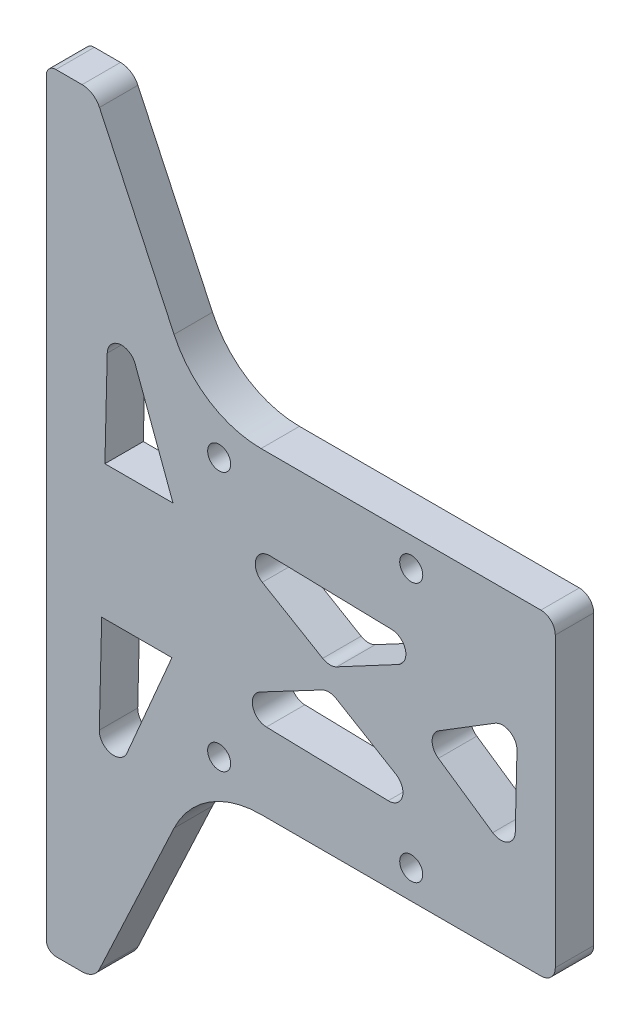
from build123d import *

# Parameters (mm, degrees)
EXTRUDE_1_DEPTH     = 11
CUT_EXTRUDE_START   = -7
CUT_EXTRUDE_1_DEPTH = 7
SKETCH_3_R          = 2.05
CUT_EXTRUDE_2_DEPTH = 37
FILLET_1_R          = 2
EXTRUDE_START       = -4
EXTRUDE_2_DEPTH     = 4
SKETCH_5_W          = 34.461524683
SKETCH_5_H          = 8.345685775
CUT_EXTRUDE_3_DEPTH = 34
SKETCH_6_R          = 1.2
CUT_EXTRUDE_4_DEPTH = 10


with BuildPart() as part:
    # 草图1 → 凸台-拉伸1 (new body)
    with BuildSketch(Plane.XY):
        with BuildLine():
            Line((3.72790966, 78.977626184), (1, 78.977626184))
            ThreePointArc((1, 78.977626184), (0.292893219, 78.684732965), (0, 77.977626184))
            Line((0, 77.977626184), (0, -0.022373816))
            ThreePointArc((0, -0.022373816), (0.292893219, -0.729480597), (1, -1.022373816))
            Line((1, -1.022373816), (3.72790966, -1.022373816))
            ThreePointArc((3.72790966, -1.022373816), (4.801278091, -0.709940174), (5.539290113, 0.129745972))
            Line((5.539290113, 0.129745972), (13.303549433, 16.717027245))
            ThreePointArc((13.303549433, 16.717027245), (16.993609545, 20.915457973), (22.360451698, 22.477626184))
            Line((22.360451698, 22.477626184), (51.5, 22.477626184))
            ThreePointArc((51.5, 22.477626184), (52.560660172, 22.916966012), (53, 23.977626184))
            Line((53, 23.977626184), (53, 53.977626184))
            ThreePointArc((53, 53.977626184), (52.560660172, 55.038286356), (51.5, 55.477626184))
            Line((51.5, 55.477626184), (22.360451698, 55.477626184))
            ThreePointArc((22.360451698, 55.477626184), (16.993609545, 57.039794395), (13.303549433, 61.238225124))
            Line((13.303549433, 61.238225124), (5.539290113, 77.825506396))
            ThreePointArc((5.539290113, 77.825506396), (4.801278091, 78.665192542), (3.72790966, 78.977626184))
        make_face()
        with BuildLine():
            Line((46.723063893, 42.88691809), (40.887588257, 39.289675292))
            ThreePointArc((40.887588257, 39.289675292), (40.373853978, 38.759625352), (40.175145399, 38.048716955))
            ThreePointArc((40.175145399, 38.048716955), (40.339583189, 37.329108685), (40.827345936, 36.77506595))
            Line((40.827345936, 36.77506595), (46.483868127, 32.90251016))
            ThreePointArc((46.483868127, 32.90251016), (48.014920506, 32.805104134), (48.830807058, 34.104310989))
            Line((48.830807058, 34.104310989), (49.009760503, 41.574109577))
            ThreePointArc((49.009760503, 41.574109577), (48.257024254, 42.91089582), (46.723063893, 42.88691809))
        make_face(mode=Mode.SUBTRACT)
        with BuildLine():
            Line((35.975157614, 45.967771208), (23.29289503, 46.27159929))
            ThreePointArc((23.29289503, 46.27159929), (22.222016888, 45.857788357), (21.757400208, 44.807954643))
            ThreePointArc((21.757400208, 44.807954643), (21.945365563, 44.044228792), (22.493939434, 43.480602267))
            Line((22.493939434, 43.480602267), (28.780793319, 39.766059947))
            ThreePointArc((28.780793319, 39.766059947), (29.511034587, 39.557845657), (30.249678725, 39.733943182))
            Line((30.249678725, 39.733943182), (36.645087423, 43.144657419))
            ThreePointArc((36.645087423, 43.144657419), (37.398702379, 44.814536207), (35.975157614, 45.967771208))
        make_face(mode=Mode.SUBTRACT)
        with BuildLine():
            Line((28.711627706, 36.878978358), (22.254110192, 33.469752057))
            ThreePointArc((22.254110192, 33.469752057), (21.679175619, 32.933041346), (21.454853835, 32.179192628))
            ThreePointArc((21.454853835, 32.179192628), (21.868664769, 31.108314486), (22.918498482, 30.643697806))
            Line((22.918498482, 30.643697806), (35.600761065, 30.339869724))
            ThreePointArc((35.600761065, 30.339869724), (37.077896972, 31.42361332), (36.405111016, 33.127664295))
            Line((36.405111016, 33.127664295), (30.180365947, 36.840718678))
            ThreePointArc((30.180365947, 36.840718678), (29.451001862, 37.051985174), (28.711627706, 36.878978358))
        make_face(mode=Mode.SUBTRACT)
        with BuildLine():
            Line((8.398953615, 21.036666397), (15.693636896, 38.077972893))
            ThreePointArc((15.693636896, 38.077972893), (15.814233328, 38.63232963), (15.720321381, 39.191825329))
            Line((15.720321381, 39.191825329), (9.25005307, 56.562897813))
            ThreePointArc((9.25005307, 56.562897813), (7.596092236, 57.518632984), (6.344825548, 56.075252289))
            Line((6.344825548, 56.075252289), (5.520410579, 21.66287331))
            ThreePointArc((5.520410579, 21.66287331), (6.701123529, 20.161229848), (8.398953615, 21.036666397))
        make_face(mode=Mode.SUBTRACT)
    extrude(amount=EXTRUDE_1_DEPTH)

    # 草图2 → 切除-拉伸1 (cut)
    with BuildSketch(Plane.XY.offset(11).offset(CUT_EXTRUDE_START)):
        with BuildLine():
            Line((23, 22.477626184), (23, 27.477626184))
            Line((23, 27.477626184), (53, 27.477626184))
            Line((53, 27.477626184), (53, 50.477626184))
            Line((53, 50.477626184), (23, 50.477626184))
            Line((23, 50.477626184), (23, 55.477626184))
            Line((23, 55.477626184), (22.360451698, 55.477626184))
            ThreePointArc((22.360451698, 55.477626184), (16.993609545, 57.039794395), (13.303549433, 61.238225124))
            Line((13.303549433, 61.238225124), (5.539290113, 77.825506396))
            ThreePointArc((5.539290113, 77.825506396), (4.801278091, 78.665192542), (3.72790966, 78.977626184))
            Line((3.72790966, 78.977626184), (1, 78.977626184))
            ThreePointArc((1, 78.977626184), (0.292893219, 78.684732965), (0, 77.977626184))
            Line((0, 77.977626184), (0, -0.022373816))
            ThreePointArc((0, -0.022373816), (0.292893219, -0.729480597), (1, -1.022373816))
            Line((1, -1.022373816), (3.72790966, -1.022373816))
            ThreePointArc((3.72790966, -1.022373816), (4.801278091, -0.709940174), (5.539290113, 0.129745972))
            Line((5.539290113, 0.129745972), (13.303549433, 16.717027245))
            ThreePointArc((13.303549433, 16.717027245), (16.993609545, 20.915457973), (22.360451698, 22.477626184))
            Line((22.360451698, 22.477626184), (23, 22.477626184))
        make_face()
    extrude(amount=CUT_EXTRUDE_1_DEPTH, mode=Mode.SUBTRACT)

    # 草图3 → 切除-拉伸2 (cut)
    with BuildSketch(Plane(origin=(0, 55.477626184, 0), x_dir=(1, 0, 0), z_dir=(0, 1, 0))):
        with Locations(Location((48, -8, 0), (0, 0, 180))):
            Circle(SKETCH_3_R)
        with Locations(Location((28, -8, 0), (0, 0, 180))):
            Circle(SKETCH_3_R)
    extrude(amount=-CUT_EXTRUDE_2_DEPTH, mode=Mode.SUBTRACT)

    # 圆角1
    fillet_1_edges = [part.edges().sort_by_distance(p)[0] for p in [
        (53, 50.477626184, 7.5),
        (53, 27.477626184, 7.5),
        (23, 27.477626184, 7.5),
        (23, 22.477626184, 7.5),
        (23, 55.477626184, 7.5),
        (23, 50.477626184, 7.5),
    ]]
    fillet(fillet_1_edges, radius=FILLET_1_R)

    # 草图4 → 凸台-拉伸2 (add)
    with BuildSketch(Plane.XY.offset(4).offset(EXTRUDE_START)):
        with BuildLine():
            Line((5.935218909, 38.977626184), (15.782413333, 38.977626184))
            ThreePointArc((15.782413333, 38.977626184), (15.755353714, 39.08588132), (15.720321381, 39.191825329))
            Line((15.720321381, 39.191825329), (13.192788767, 45.977626184))
            Line((13.192788767, 45.977626184), (6.102917422, 45.977626184))
            Line((6.102917422, 45.977626184), (5.935218909, 38.977626184))
        make_face()
        with BuildLine():
            Line((5.767520396, 31.977626184), (13.082329062, 31.977626184))
            Line((13.082329062, 31.977626184), (15.693636896, 38.077972893))
            ThreePointArc((15.693636896, 38.077972893), (15.807413415, 38.520952405), (15.782413333, 38.977626184))
            Line((15.782413333, 38.977626184), (5.935218909, 38.977626184))
            Line((5.935218909, 38.977626184), (5.767520396, 31.977626184))
        make_face()
    extrude(amount=EXTRUDE_2_DEPTH)

    # 草图5 → 切除-拉伸3 (cut)
    with BuildSketch(Plane(origin=(0, 55.477626184, 0), x_dir=(1, 0, 0), z_dir=(0, 1, 0))):
        with Locations((40.230762341, -8.172842887)):
            Rectangle(SKETCH_5_W, SKETCH_5_H)
    extrude(amount=-CUT_EXTRUDE_3_DEPTH, mode=Mode.SUBTRACT)

    # 草图6 → 切除-拉伸4 (cut)
    with BuildSketch(Plane.XY.offset(4)):
        with Locations((38, 52.477626184)):
            Circle(SKETCH_6_R)
        with Locations((18, 52.477626184)):
            Circle(SKETCH_6_R)
        with Locations((18, 25.477626184)):
            Circle(SKETCH_6_R)
        with Locations((38, 25.477626184)):
            Circle(SKETCH_6_R)
    extrude(amount=-CUT_EXTRUDE_4_DEPTH, mode=Mode.SUBTRACT)


solid = part.part
